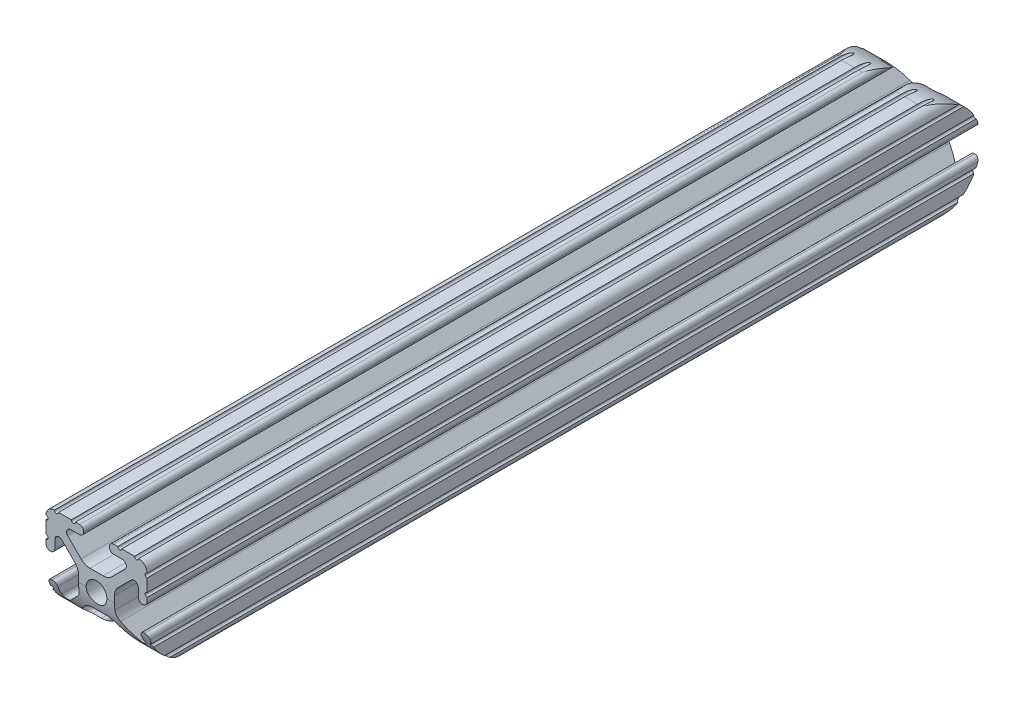
from build123d import *

# Parameters (mm, degrees)
SKETCH1_R               = 2.6035
BOSS_EXTRUDE1_DEPTH     = 104.775
CUT_EXTRUDE1_DEPTH      = 107.935602571
CUT_EXTRUDE1_DEPTH_BACK = 107.935602571
SKETCH2_R               = 3.175
CUT_EXTRUDE2_DEPTH      = 107.935602697
CUT_EXTRUDE2_DEPTH_BACK = 107.935602697


with BuildPart() as part:
    # Sketch1 → Boss-Extrude1 (new, symmetric)
    with BuildSketch(Plane.XY):
        with BuildLine():
            Line((-7.179650497, -8.645192506), (-3.952270251, -5.423690499))
            ThreePointArc((-3.952270251, -5.423690499), (-2.922936451, -4.736929036), (-1.709253557, -4.4958))
            Line((-1.709253557, -4.4958), (1.709253557, -4.4958))
            ThreePointArc((1.709253557, -4.4958), (2.922936451, -4.736929036), (3.952270251, -5.423690499))
            Line((3.952270251, -5.423690499), (7.179650497, -8.645192506))
            ThreePointArc((7.179650497, -8.645192506), (7.41473083, -9.822813117), (6.416408329, -10.4902))
            Line((6.416408329, -10.4902), (4.287512407, -10.4902))
            ThreePointArc((4.287512407, -10.4902), (3.54574862, -10.79744862), (3.2385, -11.539212407))
            Line((3.2385, -11.539212407), (3.2385, -11.650987593))
            ThreePointArc((3.2385, -11.650987593), (3.54574862, -12.39275138), (4.287512407, -12.7))
            Line((4.287512407, -12.7), (5.317126718, -12.7))
            ThreePointArc((5.317126718, -12.7), (5.825126718, -12.192), (6.333126718, -12.7))
            Line((6.333126718, -12.7), (9.550443118, -12.7))
            ThreePointArc((9.550443118, -12.7), (10.058366869, -12.192000006), (10.566443095, -12.699847501))
            ThreePointArc((10.566443095, -12.699847501), (12.082537762, -12.08250727), (12.699846982, -10.566399977))
            ThreePointArc((12.699846982, -10.566399977), (12.192000006, -10.058323491), (12.7, -9.5504))
            Line((12.7, -9.5504), (12.7, -6.3330836))
            ThreePointArc((12.7, -6.3330836), (12.192, -5.8250836), (12.7, -5.3170836))
            Line((12.7, -5.3170836), (12.7, -4.287469289))
            ThreePointArc((12.7, -4.287469289), (12.39275138, -3.545705502), (11.650987593, -3.238456882))
            Line((11.650987593, -3.238456882), (11.539212407, -3.238456882))
            ThreePointArc((11.539212407, -3.238456882), (10.79744862, -3.545705502), (10.4902, -4.287469289))
            Line((10.4902, -4.287469289), (10.4902, -6.402089023))
            ThreePointArc((10.4902, -6.402089023), (9.856505071, -7.351067942), (8.737131347, -7.129408934))
            Line((8.737131347, -7.129408934), (5.441005833, -3.840816462))
            ThreePointArc((5.441005833, -3.840816462), (4.750877967, -2.809883091), (4.5085, -1.593185507))
            Line((4.5085, -1.593185507), (4.5085, 1.593185507))
            ThreePointArc((4.5085, 1.593185507), (4.750877967, 2.809883091), (5.441005833, 3.840816462))
            Line((5.441005833, 3.840816462), (8.737131347, 7.129408934))
            ThreePointArc((8.737131347, 7.129408934), (9.856505071, 7.351067942), (10.4902, 6.402089023))
            Line((10.4902, 6.402089023), (10.4902, 4.287469289))
            ThreePointArc((10.4902, 4.287469289), (10.79744862, 3.545705502), (11.539212407, 3.238456882))
            Line((11.539212407, 3.238456882), (11.650987593, 3.238456882))
            ThreePointArc((11.650987593, 3.238456882), (12.39275138, 3.545705502), (12.7, 4.287469289))
            Line((12.7, 4.287469289), (12.7, 5.3170836))
            ThreePointArc((12.7, 5.3170836), (12.192, 5.8250836), (12.7, 6.3330836))
            Line((12.7, 6.3330836), (12.7, 9.5504))
            ThreePointArc((12.7, 9.5504), (12.192000006, 10.058323491), (12.699846982, 10.566399977))
            ThreePointArc((12.699846982, 10.566399977), (12.082537762, 12.08250727), (10.566443095, 12.699847501))
            ThreePointArc((10.566443095, 12.699847501), (10.058366869, 12.192000006), (9.550443118, 12.7))
            Line((9.550443118, 12.7), (6.333126718, 12.7))
            ThreePointArc((6.333126718, 12.7), (5.825126718, 12.192), (5.317126718, 12.7))
            Line((5.317126718, 12.7), (4.287512407, 12.7))
            ThreePointArc((4.287512407, 12.7), (3.54574862, 12.39275138), (3.2385, 11.650987593))
            Line((3.2385, 11.650987593), (3.2385, 11.539212407))
            ThreePointArc((3.2385, 11.539212407), (3.54574862, 10.79744862), (4.287512407, 10.4902))
            Line((4.287512407, 10.4902), (6.476788598, 10.4902))
            ThreePointArc((6.476788598, 10.4902), (7.432222385, 9.85140422), (7.207036008, 8.724370562))
            Line((7.207036008, 8.724370562), (3.898272566, 5.423169045))
            ThreePointArc((3.898272566, 5.423169045), (2.869120213, 4.736787962), (1.655778399, 4.4958))
            Line((1.655778399, 4.4958), (-1.655778399, 4.4958))
            ThreePointArc((-1.655778399, 4.4958), (-2.869120213, 4.736787962), (-3.898272566, 5.423169045))
            Line((-3.898272566, 5.423169045), (-7.207036008, 8.724370562))
            ThreePointArc((-7.207036008, 8.724370562), (-7.432222385, 9.85140422), (-6.476788598, 10.4902))
            Line((-6.476788598, 10.4902), (-4.287512407, 10.4902))
            ThreePointArc((-4.287512407, 10.4902), (-3.54574862, 10.79744862), (-3.2385, 11.539212407))
            Line((-3.2385, 11.539212407), (-3.2385, 11.650987593))
            ThreePointArc((-3.2385, 11.650987593), (-3.54574862, 12.39275138), (-4.287512407, 12.7))
            Line((-4.287512407, 12.7), (-5.317126718, 12.7))
            ThreePointArc((-5.317126718, 12.7), (-5.825126718, 12.192), (-6.333126718, 12.7))
            Line((-6.333126718, 12.7), (-9.550443118, 12.7))
            ThreePointArc((-9.550443118, 12.7), (-10.058366869, 12.192000006), (-10.566443095, 12.699847501))
            ThreePointArc((-10.566443095, 12.699847501), (-12.082537762, 12.08250727), (-12.699846982, 10.566399977))
            ThreePointArc((-12.699846982, 10.566399977), (-12.192000006, 10.058323491), (-12.7, 9.5504))
            Line((-12.7, 9.5504), (-12.7, 6.3330836))
            ThreePointArc((-12.7, 6.3330836), (-12.192, 5.8250836), (-12.7, 5.3170836))
            Line((-12.7, 5.3170836), (-12.7, 4.287469289))
            ThreePointArc((-12.7, 4.287469289), (-12.39275138, 3.545705502), (-11.650987593, 3.238456882))
            Line((-11.650987593, 3.238456882), (-11.539212407, 3.238456882))
            ThreePointArc((-11.539212407, 3.238456882), (-10.79744862, 3.545705502), (-10.4902, 4.287469289))
            Line((-10.4902, 4.287469289), (-10.4902, 6.402089023))
            ThreePointArc((-10.4902, 6.402089023), (-9.856505071, 7.351067942), (-8.737131347, 7.129408934))
            Line((-8.737131347, 7.129408934), (-5.441005833, 3.840816462))
            ThreePointArc((-5.441005833, 3.840816462), (-4.750877967, 2.809883091), (-4.5085, 1.593185507))
            Line((-4.5085, 1.593185507), (-4.5085, -1.593185507))
            ThreePointArc((-4.5085, -1.593185507), (-4.750877967, -2.809883091), (-5.441005833, -3.840816462))
            Line((-5.441005833, -3.840816462), (-8.737131347, -7.129408934))
            ThreePointArc((-8.737131347, -7.129408934), (-9.856505071, -7.351067942), (-10.4902, -6.402089023))
            Line((-10.4902, -6.402089023), (-10.4902, -4.287469289))
            ThreePointArc((-10.4902, -4.287469289), (-10.79744862, -3.545705502), (-11.539212407, -3.238456882))
            Line((-11.539212407, -3.238456882), (-11.650987593, -3.238456882))
            ThreePointArc((-11.650987593, -3.238456882), (-12.39275138, -3.545705502), (-12.7, -4.287469289))
            Line((-12.7, -4.287469289), (-12.7, -5.3170836))
            ThreePointArc((-12.7, -5.3170836), (-12.192, -5.8250836), (-12.7, -6.3330836))
            Line((-12.7, -6.3330836), (-12.7, -9.5504))
            ThreePointArc((-12.7, -9.5504), (-12.192000006, -10.058323491), (-12.699846982, -10.566399977))
            ThreePointArc((-12.699846982, -10.566399977), (-12.082537762, -12.08250727), (-10.566443095, -12.699847501))
            ThreePointArc((-10.566443095, -12.699847501), (-10.058366869, -12.192000006), (-9.550443118, -12.7))
            Line((-9.550443118, -12.7), (-6.333126718, -12.7))
            ThreePointArc((-6.333126718, -12.7), (-5.825126718, -12.192), (-5.317126718, -12.7))
            Line((-5.317126718, -12.7), (-4.287512407, -12.7))
            ThreePointArc((-4.287512407, -12.7), (-3.54574862, -12.39275138), (-3.2385, -11.650987593))
            Line((-3.2385, -11.650987593), (-3.2385, -11.539212407))
            ThreePointArc((-3.2385, -11.539212407), (-3.54574862, -10.79744862), (-4.287512407, -10.4902))
            Line((-4.287512407, -10.4902), (-6.416408329, -10.4902))
            ThreePointArc((-6.416408329, -10.4902), (-7.41473083, -9.822813117), (-7.179650497, -8.645192506))
        make_face()
        Circle(SKETCH1_R, mode=Mode.SUBTRACT)
    extrude(amount=BOSS_EXTRUDE1_DEPTH, both=True)

    # Sketch2 → Cut-Extrude1 (cut, two sides: drawn at the far end of the back side and taken through both)
    with BuildSketch(Plane(origin=(4.5085, 0, 0), x_dir=(0, 0, -1), z_dir=(1, 0, 0)).offset(-CUT_EXTRUDE1_DEPTH_BACK)):
        with Locations(Location((-92.075, 0, 0), (0, 0, 149.881456627))):
            Circle(SKETCH2_R)
        with Locations(Location((-66.675, 0, 0), (0, 0, 149.881456627))):
            Circle(SKETCH2_R)
        with BuildLine():
            Line((-104.775, 0), (-104.775, -12.7))
            Line((-104.775, -12.7), (-92.075, -12.7))
            ThreePointArc((-92.075, -12.7), (-101.055256121, -8.980256121), (-104.775, 0))
        make_face()
    extrude(amount=CUT_EXTRUDE1_DEPTH + CUT_EXTRUDE1_DEPTH_BACK, mode=Mode.SUBTRACT)

    # Sketch3 → Cut-Extrude2 (cut, two sides: drawn at the far end of the back side and taken through both)
    with BuildSketch(Plane(origin=(4.5085, 0, 0), x_dir=(0, 0, -1), z_dir=(1, 0, 0)).offset(-CUT_EXTRUDE2_DEPTH_BACK)):
        with BuildLine():
            Line((104.775, 12.7), (92.075, 12.7))
            ThreePointArc((92.075, 12.7), (100.473111218, 9.52689498), (104.674673009, 1.593185507))
            Line((104.674673009, 1.593185507), (104.775, 1.593185507))
            Line((104.775, 1.593185507), (104.775, 12.7))
        make_face()
        with BuildLine():
            Line((104.775, -12.7), (104.775, -1.593185507))
            Line((104.775, -1.593185507), (104.674673009, -1.593185507))
            ThreePointArc((104.674673009, -1.593185507), (100.473111218, -9.52689498), (92.075, -12.7))
            Line((92.075, -12.7), (104.775, -12.7))
        make_face()
    extrude(amount=CUT_EXTRUDE2_DEPTH + CUT_EXTRUDE2_DEPTH_BACK, mode=Mode.SUBTRACT)


solid = part.part
